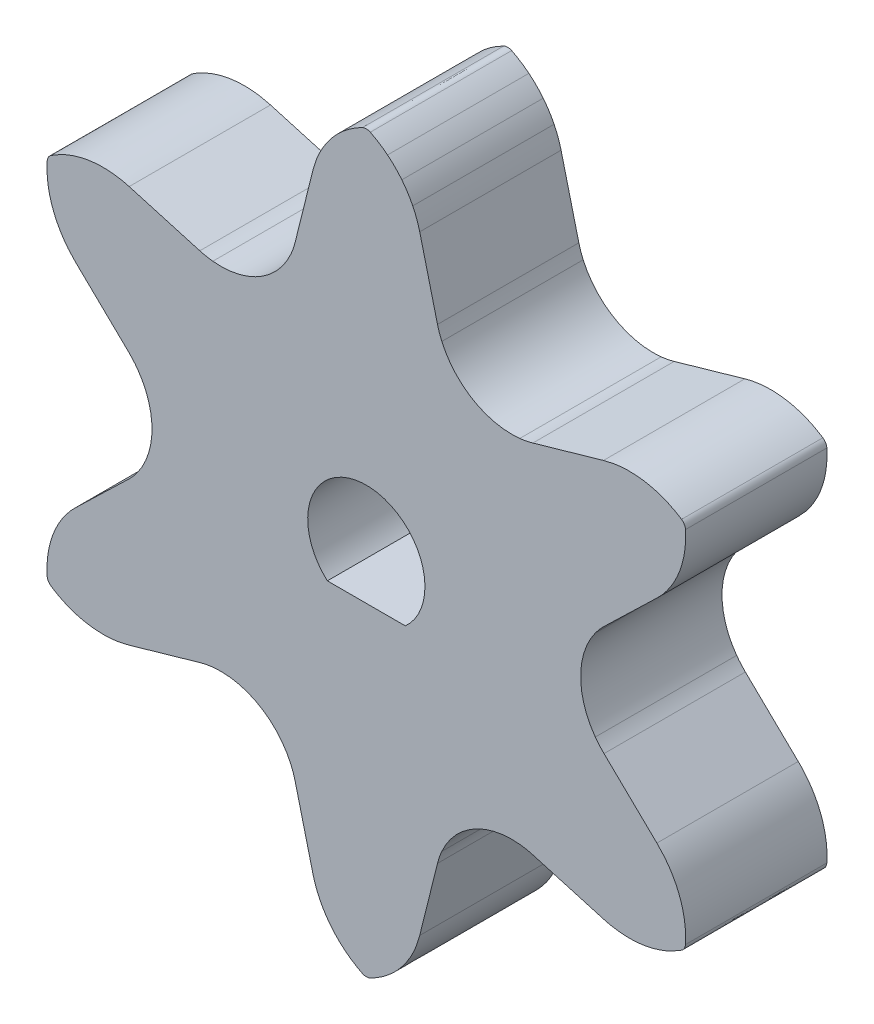
from build123d import *

# Parameters (mm, degrees)
BOSS_EXTRUDE1_DEPTH = 4.7625


with BuildPart() as part:
    # Sketch1 → Boss-Extrude1 (new body)
    with BuildSketch(Plane.XY):
        with BuildLine():
            ThreePointArc((0.13375119, -12.340042072), (1.193950707, -11.485860744), (1.798906697, -10.266157088))
            Line((1.798906697, -10.266157088), (2.398140588, -7.862761221))
            ThreePointArc((2.398140588, -7.862761221), (2.461635419, -7.64822635), (2.543491476, -7.440004377))
            ThreePointArc((2.543491476, -7.440004377), (3.61061, -6.253759966), (5.171487057, -5.922730421))
            ThreePointArc((5.171487057, -5.922730421), (5.392740604, -5.955951983), (5.610280667, -6.008231282))
            Line((5.610280667, -6.008231282), (7.991299489, -6.690977442))
            ThreePointArc((7.991299489, -6.690977442), (9.350071835, -6.776922016), (10.619914323, -6.285852964))
            ThreePointArc((10.619914323, -6.285852964), (10.714040096, -6.185753934), (10.753665513, -6.054189108))
            ThreePointArc((10.753665513, -6.054189108), (10.544022542, -4.708938729), (9.790206185, -3.575179646))
            Line((9.790206185, -3.575179646), (8.008421255, -1.854529939))
            ThreePointArc((8.008421255, -1.854529939), (7.854376023, -1.692274367), (7.714978533, -1.517273956))
            ThreePointArc((7.714978533, -1.517273956), (7.22122, 0), (7.714978533, 1.517273956))
            ThreePointArc((7.714978533, 1.517273956), (7.854376023, 1.692274367), (8.008421255, 1.854529939))
            Line((8.008421255, 1.854529939), (9.790205754, 3.575179229))
            ThreePointArc((9.790205754, 3.575179229), (10.544022434, 4.708938449), (10.753665513, 6.054189108))
            ThreePointArc((10.753665513, 6.054189108), (10.714040096, 6.185753934), (10.619914323, 6.285852964))
            ThreePointArc((10.619914323, 6.285852964), (9.350071835, 6.776922015), (7.991299489, 6.690977442))
            Line((7.991299489, 6.690977442), (5.610280667, 6.008231282))
            ThreePointArc((5.610280667, 6.008231282), (5.392740604, 5.955951983), (5.171487057, 5.922730421))
            ThreePointArc((5.171487057, 5.922730421), (3.61061, 6.253759966), (2.543491476, 7.440004377))
            ThreePointArc((2.543491476, 7.440004377), (2.461635419, 7.64822635), (2.398140588, 7.862761221))
            Line((2.398140588, 7.862761221), (1.798906697, 10.266157088))
            ThreePointArc((1.798906697, 10.266157088), (1.193950707, 11.485860744), (0.13375119, 12.340042072))
            ThreePointArc((0.13375119, 12.340042072), (0, 12.371507867), (-0.13375119, 12.340042072))
            ThreePointArc((-0.13375119, 12.340042072), (-1.193950707, 11.485860744), (-1.798906697, 10.266157088))
            Line((-1.798906697, 10.266157088), (-2.398140588, 7.862761221))
            ThreePointArc((-2.398140588, 7.862761221), (-2.461635419, 7.64822635), (-2.543491476, 7.440004377))
            ThreePointArc((-2.543491476, 7.440004377), (-3.61061, 6.253759966), (-5.171487057, 5.922730421))
            ThreePointArc((-5.171487057, 5.922730421), (-5.392740604, 5.955951983), (-5.610280667, 6.008231282))
            Line((-5.610280667, 6.008231282), (-7.991299489, 6.690977442))
            ThreePointArc((-7.991299489, 6.690977442), (-9.350071835, 6.776922016), (-10.619914323, 6.285852964))
            ThreePointArc((-10.619914323, 6.285852964), (-10.714040096, 6.185753934), (-10.753665513, 6.054189108))
            ThreePointArc((-10.753665513, 6.054189108), (-10.544022542, 4.708938729), (-9.790206185, 3.575179646))
            Line((-9.790206185, 3.575179646), (-8.008421255, 1.854529939))
            ThreePointArc((-8.008421255, 1.854529939), (-7.854376023, 1.692274367), (-7.714978533, 1.517273956))
            ThreePointArc((-7.714978533, 1.517273956), (-7.22122, 0), (-7.714978533, -1.517273956))
            ThreePointArc((-7.714978533, -1.517273956), (-7.854376023, -1.692274367), (-8.008421255, -1.854529939))
            Line((-8.008421255, -1.854529939), (-9.790205754, -3.575179229))
            ThreePointArc((-9.790205754, -3.575179229), (-10.544022434, -4.708938449), (-10.753665513, -6.054189108))
            ThreePointArc((-10.753665513, -6.054189108), (-10.714040096, -6.185753934), (-10.619914323, -6.285852964))
            ThreePointArc((-10.619914323, -6.285852964), (-9.350071835, -6.776922015), (-7.991299489, -6.690977442))
            Line((-7.991299489, -6.690977442), (-5.610280667, -6.008231282))
            ThreePointArc((-5.610280667, -6.008231282), (-5.392740604, -5.955951983), (-5.171487057, -5.922730421))
            ThreePointArc((-5.171487057, -5.922730421), (-3.61061, -6.253759966), (-2.543491476, -7.440004377))
            ThreePointArc((-2.543491476, -7.440004377), (-2.461635419, -7.64822635), (-2.398140588, -7.862761221))
            Line((-2.398140588, -7.862761221), (-1.798906697, -10.266157088))
            ThreePointArc((-1.798906697, -10.266157088), (-1.193950707, -11.485860744), (-0.13375119, -12.340042072))
            ThreePointArc((-0.13375119, -12.340042072), (0, -12.371507867), (0.13375119, -12.340042072))
        make_face()
        with BuildLine():
            Line((1.313392554, -1.475), (-1.313392554, -1.475))
            ThreePointArc((-1.313392554, -1.475), (0, 1.975), (1.313392554, -1.475))
        make_face(mode=Mode.SUBTRACT)
    extrude(amount=BOSS_EXTRUDE1_DEPTH)


solid = part.part
